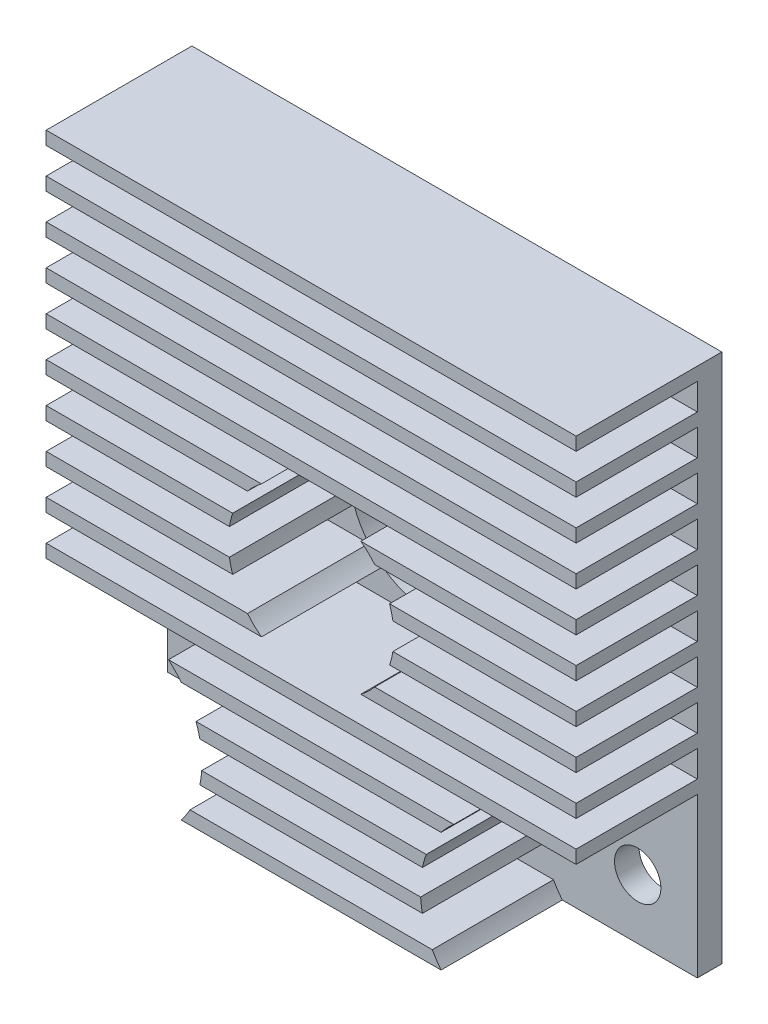
from build123d import *
from build123d.topology import SkipClean

# Parameters (mm, degrees)
SKETCH_1_W          = 40
SKETCH_1_H          = 40
SKETCH_1_R          = 6.25
EXTRUDE_1_DEPTH     = 1.85
SKETCH_2_W          = 40
SKETCH_2_H          = 1
EXTRUDE_2_DEPTH     = 9.15
SKETCH_3_R          = 1.75
SKETCH_3_R_2        = 6.25
CUT_EXTRUDE_5_DEPTH = 31.347981811
SKETCH_4_R          = 7.255719344
CUT_EXTRUDE_6_DEPTH = 16.15


with BuildPart() as part:
    # 草图1 → 凸台-拉伸1 (new body)
    with BuildSketch(Plane.XY):
        Rectangle(SKETCH_1_W, SKETCH_1_H)
        Circle(SKETCH_1_R, mode=Mode.SUBTRACT)
    extrude(amount=EXTRUDE_1_DEPTH)

    # 草图2 → 凸台-拉伸2 (add)
    with BuildSketch(Plane.XY.offset(1.85)):
        with Locations((0, 19.5)):
            Rectangle(SKETCH_2_W, SKETCH_2_H)
        with Locations((0, 16.5)):
            Rectangle(SKETCH_2_W, SKETCH_2_H)
        with Locations((0, 13.5)):
            Rectangle(SKETCH_2_W, SKETCH_2_H)
        with Locations((0, 10.5)):
            Rectangle(SKETCH_2_W, SKETCH_2_H)
        with Locations((0, 7.5)):
            Rectangle(SKETCH_2_W, SKETCH_2_H)
        with Locations((0, 4.5)):
            Rectangle(SKETCH_2_W, SKETCH_2_H)
        with Locations((0, 1.5)):
            Rectangle(SKETCH_2_W, SKETCH_2_H)
        with Locations((0, -1.5)):
            Rectangle(SKETCH_2_W, SKETCH_2_H)
        with Locations((0, -4.5)):
            Rectangle(SKETCH_2_W, SKETCH_2_H)
        with Locations((0, -7.5)):
            Rectangle(SKETCH_2_W, SKETCH_2_H)
        with Locations((0, -10.5)):
            Rectangle(SKETCH_2_W, SKETCH_2_H)
        with Locations((0, -13.5)):
            Rectangle(SKETCH_2_W, SKETCH_2_H)
        with Locations((0, -16.5)):
            Rectangle(SKETCH_2_W, SKETCH_2_H)
        with Locations((0, -19.5)):
            Rectangle(SKETCH_2_W, SKETCH_2_H)
    extrude(amount=EXTRUDE_2_DEPTH)

    # 草图3 → 切除-拉伸5 (cut, through all)
    with SkipClean():  # the faces are left unmerged after this step: merging them gives an invalid solid
        with BuildSketch(Plane(origin=(0, 0, 0), x_dir=(-1, 0, 0), z_dir=(0, 0, -1))):
            with Locations((-15.5, -15.5)):
                Circle(SKETCH_3_R)
            with Locations((15.5, -15.5)):
                Circle(SKETCH_3_R)
            with Locations(Location((0, 0, 0), (0, 0, 350.793103779))):
                Circle(SKETCH_3_R_2)
        extrude(amount=-CUT_EXTRUDE_5_DEPTH, mode=Mode.SUBTRACT)

    # 草图4 → 切除-拉伸6 (cut)
    with SkipClean():  # the faces are left unmerged after this step: merging them gives an invalid solid
        with BuildSketch(Plane.XY.offset(1.85)):
            with Locations((-15.5, -15.5)):
                Circle(SKETCH_4_R)
            with Locations((15.5, -15.5)):
                Circle(SKETCH_4_R)
        extrude(amount=CUT_EXTRUDE_6_DEPTH, mode=Mode.SUBTRACT)


solid = part.part
